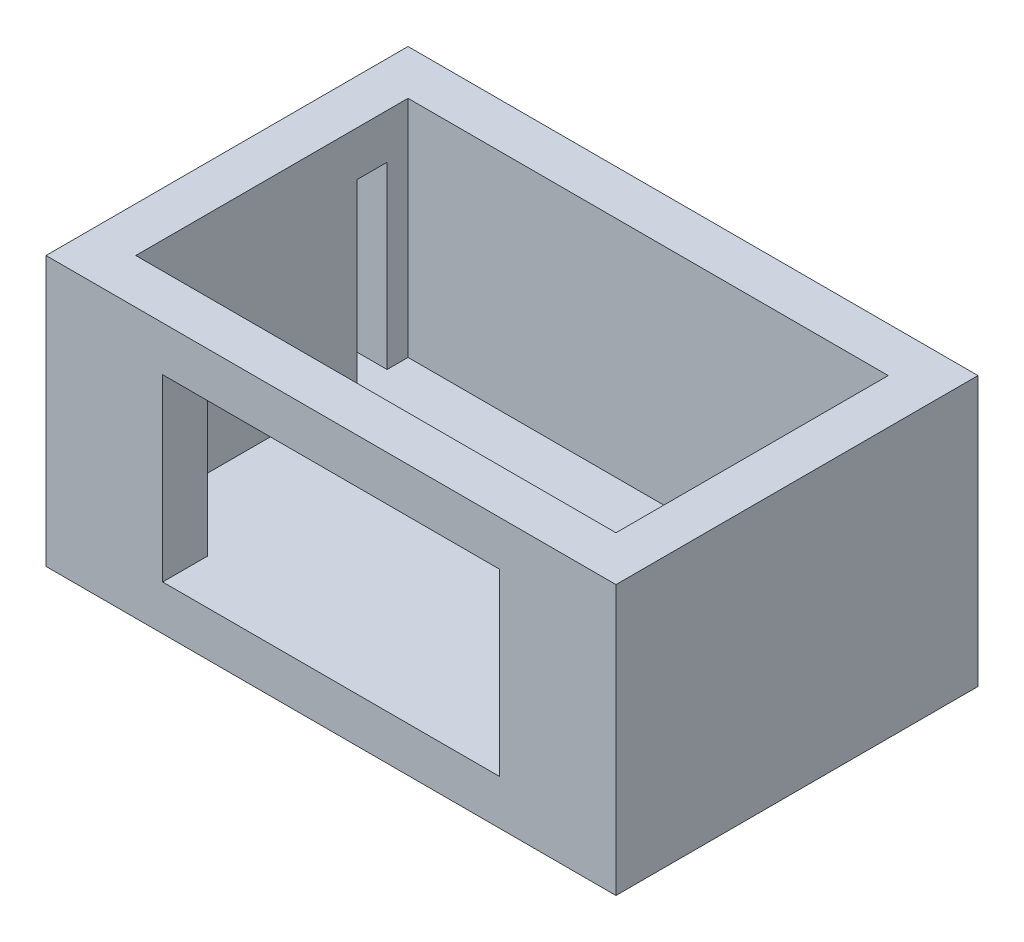
from build123d import *

# Parameters (mm, degrees)
SKETCH1_W           = 38.1
SKETCH1_H           = 24.2
BOSS_EXTRUDE1_DEPTH = 18
SHELL1_T            = -3
SKETCH2_W           = 22.5
SKETCH2_H           = 12
CUT_EXTRUDE1_DEPTH  = 3
SKETCH3_W           = 2
SKETCH3_H           = 12
CUT_EXTRUDE2_DEPTH  = 3


with BuildPart() as part:
    # Sketch1 → Boss-Extrude1 (new body)
    with BuildSketch(Plane(origin=(0, 0, 0), x_dir=(1, 0, 0), z_dir=(0, 1, 0))):
        with Locations((-18.614066742, 14.699432105)):
            Rectangle(SKETCH1_W, SKETCH1_H)
    extrude(amount=BOSS_EXTRUDE1_DEPTH)

    # Shell1
    shell1_openings = [part.faces().sort_by_distance(p)[0] for p in [
        (-18.614066742, 18, -14.699432105),
    ]]
    offset(amount=SHELL1_T, openings=shell1_openings, kind=Kind.INTERSECTION)

    # Sketch2 → Cut-Extrude1 (cut)
    with BuildSketch(Plane.XY.offset(-2.599432105)):
        with Locations((-18.614066742, 9)):
            Rectangle(SKETCH2_W, SKETCH2_H)
    extrude(amount=-CUT_EXTRUDE1_DEPTH, mode=Mode.SUBTRACT)

    # Sketch3 → Cut-Extrude2 (cut)
    with BuildSketch(Plane.ZY.offset(37.664066742)):
        with Locations((-21.399432105, 9)):
            Rectangle(SKETCH3_W, SKETCH3_H)
    extrude(amount=-CUT_EXTRUDE2_DEPTH, mode=Mode.SUBTRACT)


solid = part.part
